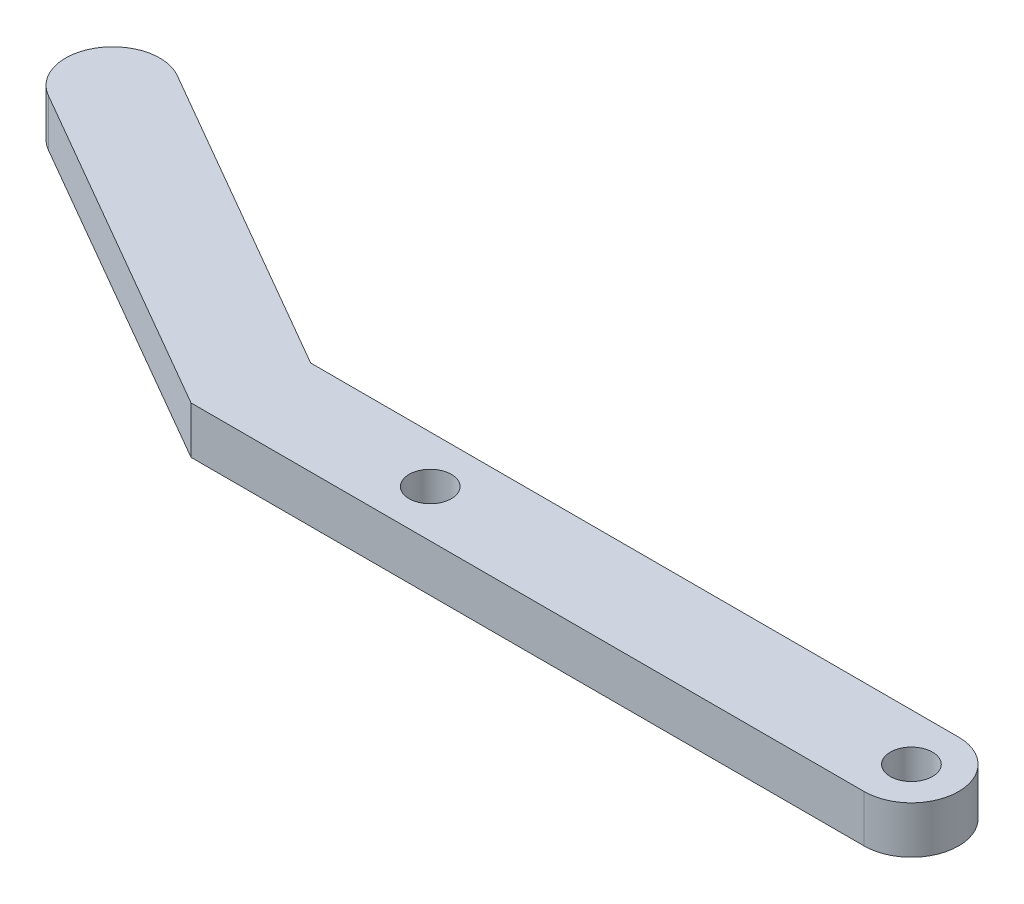
from build123d import *

# Parameters (mm, degrees)
SKETCH1_R           = 1.4224
BOSS_EXTRUDE1_DEPTH = 3.175


with BuildPart() as part:
    # Sketch1 → Boss-Extrude1 (new body)
    with BuildSketch(Plane(origin=(0, 0, 0), x_dir=(1, 0, 0), z_dir=(0, 1, 0))):
        with BuildLine():
            Line((-21.374261314, 3.175), (22.225, 3.175))
            ThreePointArc((22.225, 3.175), (25.4, 0), (22.225, -3.175))
            Line((22.225, -3.175), (-23.075738686, -3.175))
            Line((-23.075738686, -3.175), (-45.809545256, 9.950369343))
            ThreePointArc((-45.809545256, 9.950369343), (-46.971675913, 14.2875), (-42.634545256, 15.449630657))
            Line((-42.634545256, 15.449630657), (-21.374261314, 3.175))
        make_face()
        with Locations(Location((22.225, 0, 0), (0, 0, 270))):
            Circle(SKETCH1_R, mode=Mode.SUBTRACT)
        with Locations(Location((-10.15492, 0, 0), (0, 0, 270))):
            Circle(SKETCH1_R, mode=Mode.SUBTRACT)
    extrude(amount=BOSS_EXTRUDE1_DEPTH)


solid = part.part
